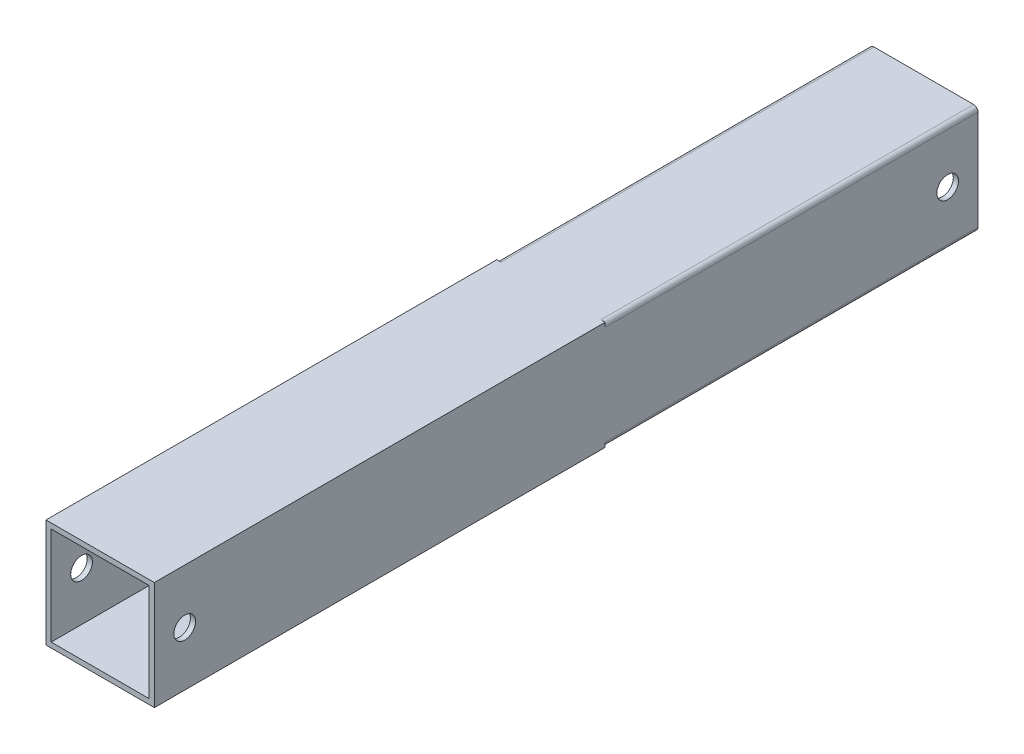
from build123d import *

# Parameters (mm, degrees)
CROQUIS1_W              = 25
CROQUIS1_H              = 25
CROQUIS1_W_2            = 22.6
CROQUIS1_H_2            = 22.6
SALIENTE_EXTRUIR1_DEPTH = 190
CROQUIS2_R              = 2.5
CORTAR_EXTRUIR1_DEPTH   = 193.044916621
CROQUIS3_R              = 40
CORTAR_EXTRUIR2_DEPTH   = 86


with BuildPart() as part:
    # Croquis1 → Saliente-Extruir1 (new body)
    with BuildSketch(Plane.XY):
        Rectangle(CROQUIS1_W, CROQUIS1_H)
        Rectangle(CROQUIS1_W_2, CROQUIS1_H_2, mode=Mode.SUBTRACT)
    extrude(amount=SALIENTE_EXTRUIR1_DEPTH)

    # Croquis2 → Cortar-Extruir1 (cut, through all)
    with BuildSketch(Plane(origin=(12.5, 0, 0), x_dir=(0, 0, -1), z_dir=(1, 0, 0))):
        with Locations(Location((-7, 0, 0), (0, 0, 90))):
            Circle(CROQUIS2_R)
        with Locations(Location((-183, 0, 0), (0, 0, 90))):
            Circle(CROQUIS2_R)
    extrude(amount=-CORTAR_EXTRUIR1_DEPTH, mode=Mode.SUBTRACT)

    # Croquis3 → Cortar-Extruir2 (cut)
    with BuildSketch(Plane(origin=(0, 0, 0), x_dir=(-1, 0, 0), z_dir=(0, 0, -1))):
        Circle(CROQUIS3_R)
        with BuildLine():
            Line((-11.5, 12.5), (11.5, 12.5))
            ThreePointArc((11.5, 12.5), (12.207106781, 12.207106781), (12.5, 11.5))
            Line((12.5, 11.5), (12.5, -11.5))
            ThreePointArc((12.5, -11.5), (12.207106781, -12.207106781), (11.5, -12.5))
            Line((11.5, -12.5), (-11.5, -12.5))
            ThreePointArc((-11.5, -12.5), (-12.207106781, -12.207106781), (-12.5, -11.5))
            Line((-12.5, -11.5), (-12.5, 11.5))
            ThreePointArc((-12.5, 11.5), (-12.207106781, 12.207106781), (-11.5, 12.5))
        make_face(mode=Mode.SUBTRACT)
    extrude(amount=-CORTAR_EXTRUIR2_DEPTH, mode=Mode.SUBTRACT)


solid = part.part
